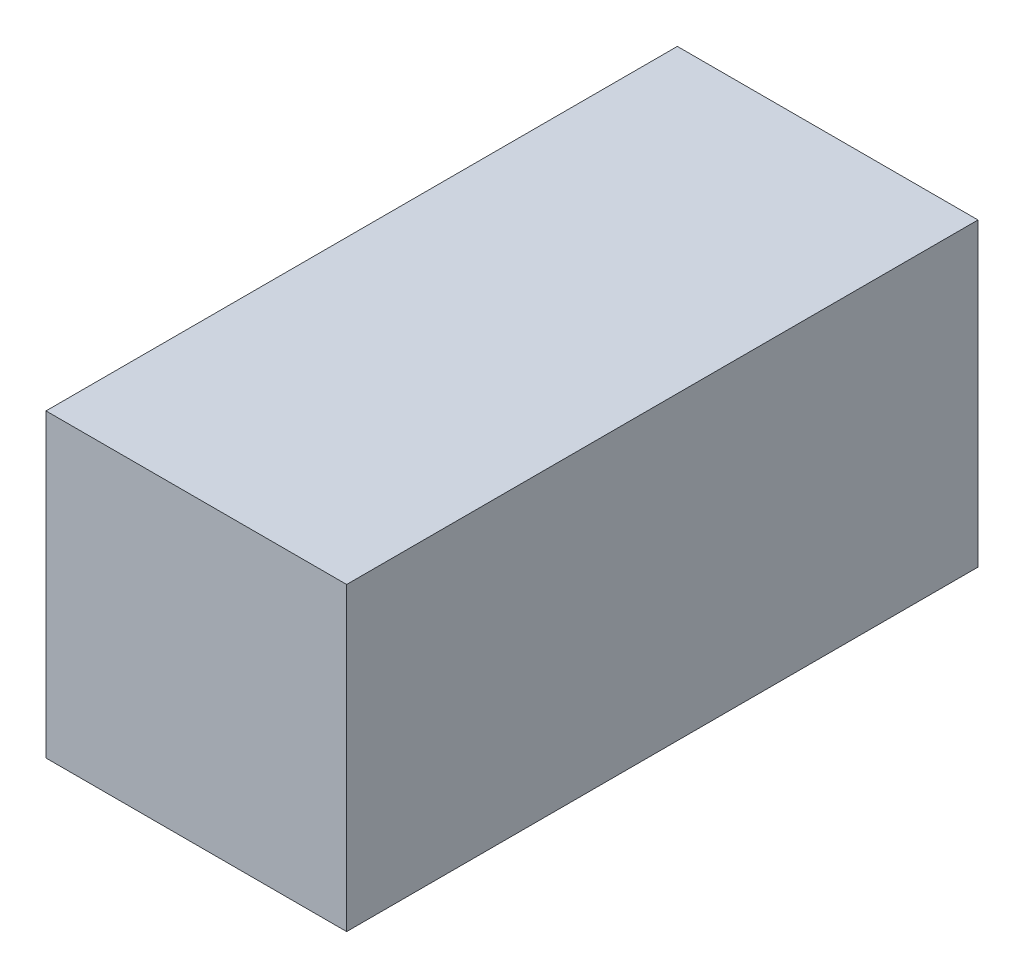
from build123d import *

# Parameters (mm, degrees)
SKETCH_1_W      = 100
SKETCH_1_H      = 210
EXTRUDE_1_DEPTH = 50


with BuildPart() as part:
    # 草图1 → 凸台-拉伸1 (new, symmetric)
    with BuildSketch(Plane(origin=(0, 0, 0), x_dir=(1, 0, 0), z_dir=(0, 1, 0))):
        Rectangle(SKETCH_1_W, SKETCH_1_H)
    extrude(amount=EXTRUDE_1_DEPTH, both=True)


solid = part.part
